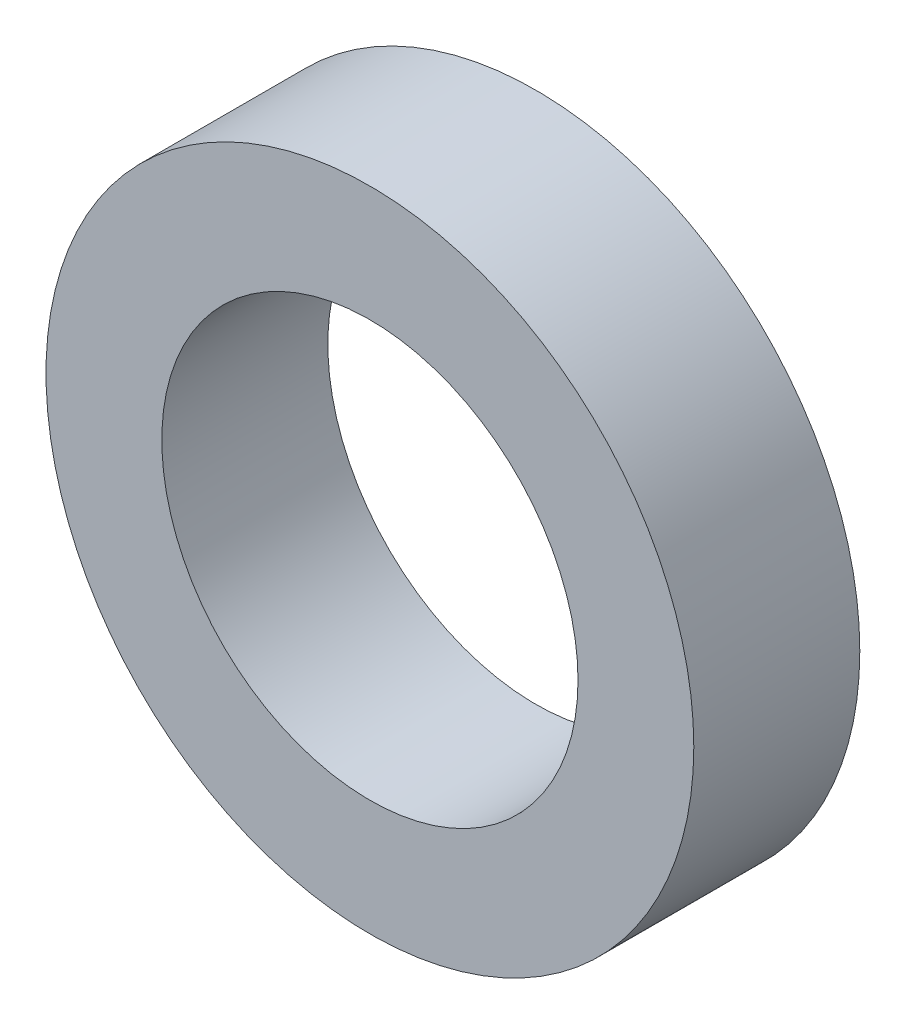
from build123d import *

# Parameters (mm, degrees)
SKETCH1_R           = 5.08
SKETCH1_R_2         = 3.2639
BOSS_EXTRUDE1_DEPTH = 2.6035


with BuildPart() as part:
    # Sketch1 → Boss-Extrude1 (new body)
    with BuildSketch(Plane.XY):
        Circle(SKETCH1_R)
        Circle(SKETCH1_R_2, mode=Mode.SUBTRACT)
    extrude(amount=BOSS_EXTRUDE1_DEPTH)


solid = part.part
